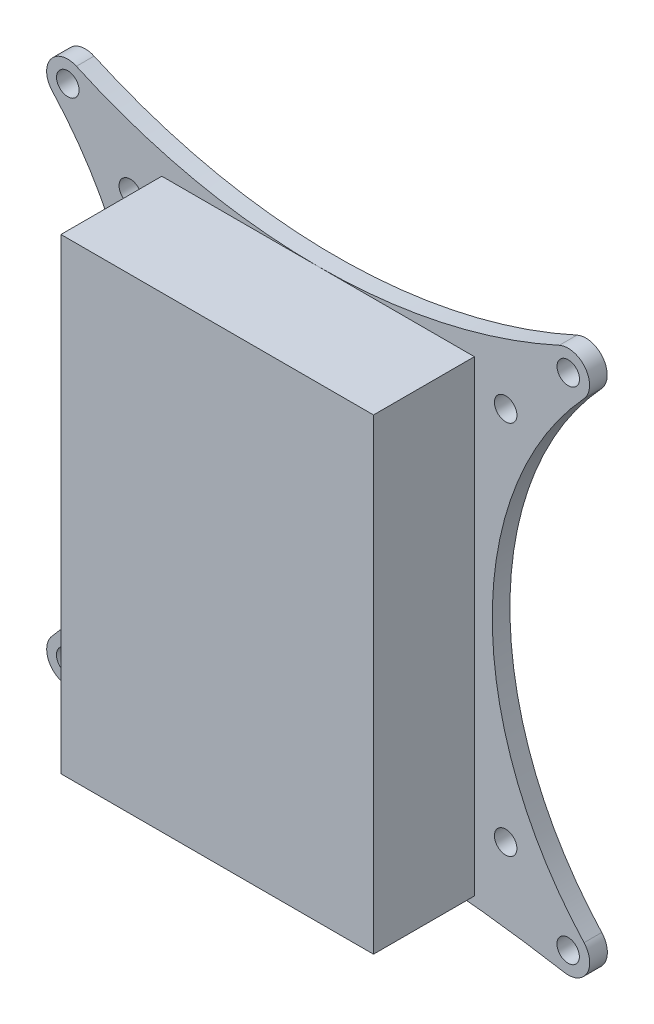
from build123d import *

# Parameters (mm, degrees)
SKETCH1_R           = 2228.848425932
SKETCH1_R_2         = 2232.515095695
SKETCH1_R_3         = 2255.383637046
SKETCH1_R_4         = 2221.194192251
SKETCH1_R_5         = 2229.264638927
SKETCH1_R_6         = 2222.153252204
SKETCH1_R_7         = 2227.962328558
SKETCH1_R_8         = 2234.328555728
BOSS_EXTRUDE1_DEPTH = 3500
SKETCH2_W           = 61968.445691345
SKETCH2_H           = 92600
BOSS_EXTRUDE2_DEPTH = 20000
SCALE1_SCALE        = 0.001


with BuildPart() as part:
    # Sketch1 → Boss-Extrude1 (new body)
    with BuildSketch(Plane.XY):
        with BuildLine():
            ThreePointArc((106545.079885482, 100518.436826227), (106853.327609477, 105879.024620733), (101661.548830659, 107248.824341048))
            ThreePointArc((101661.548830659, 107248.824341048), (53788.50438499, 96874.393209157), (5922.956321239, 107283.35638346))
            ThreePointArc((5922.956321239, 107283.35638346), (817.61837842, 105942.536812531), (1110.36774195, 100672.188584726))
            ThreePointArc((1110.36774195, 100672.188584726), (19271.211317967, 53879.37747984), (1130.518180486, 7078.750742777))
            ThreePointArc((1130.518180486, 7078.750742777), (546.608093922, 2206.067347313), (4967.687443421, 75.796977839))
            ThreePointArc((4967.687443421, 75.796977839), (53840.129347423, 4274.393209157), (102711.67644046, 65.394194326))
            ThreePointArc((102711.67644046, 65.394194326), (107170.596097397, 2217.573525566), (106569.543420865, 7132.100569023))
            ThreePointArc((106569.543420865, 7132.100569023), (88370.47645447, 53820.504464396), (106545.079885482, 100518.436826227))
        make_face()
        with Locations((103434.821241174, 103424.132598226)):
            Circle(SKETCH1_R, mode=Mode.SUBTRACT)
        with Locations((4216.199864712, 103431.93144758)):
            Circle(SKETCH1_R_2, mode=Mode.SUBTRACT)
        with Locations((4214.875121526, 4248.849141113)):
            Circle(SKETCH1_R_3, mode=Mode.SUBTRACT)
        with Locations((103411.028421454, 4238.866596861)):
            Circle(SKETCH1_R_4, mode=Mode.SUBTRACT)
        with Locations((91025.969819716, 16629.576138342)):
            Circle(SKETCH1_R_5, mode=Mode.SUBTRACT)
        with Locations((16598.170941579, 16611.164460881)):
            Circle(SKETCH1_R_6, mode=Mode.SUBTRACT)
        with Locations((16610.109502545, 91032.533832428)):
            Circle(SKETCH1_R_7, mode=Mode.SUBTRACT)
        with Locations((91028.833016767, 91029.045185522)):
            Circle(SKETCH1_R_8, mode=Mode.SUBTRACT)
    extrude(amount=BOSS_EXTRUDE1_DEPTH)

    # Sketch2 → Boss-Extrude2 (add)
    with BuildSketch(Plane.XY.offset(3500)):
        with Locations((53840.129347424, 50574.393209157)):
            Rectangle(SKETCH2_W, SKETCH2_H)
    extrude(amount=BOSS_EXTRUDE2_DEPTH)


with BuildPart() as part_1:
    # Scale1: scaled about (53841.453243905, 50705.922203797, 11214.696487876)
    add(part.part.scale(SCALE1_SCALE).moved(Location((53787.611790661, 50655.216281593, 11203.481791388))))


solid = part_1.part
